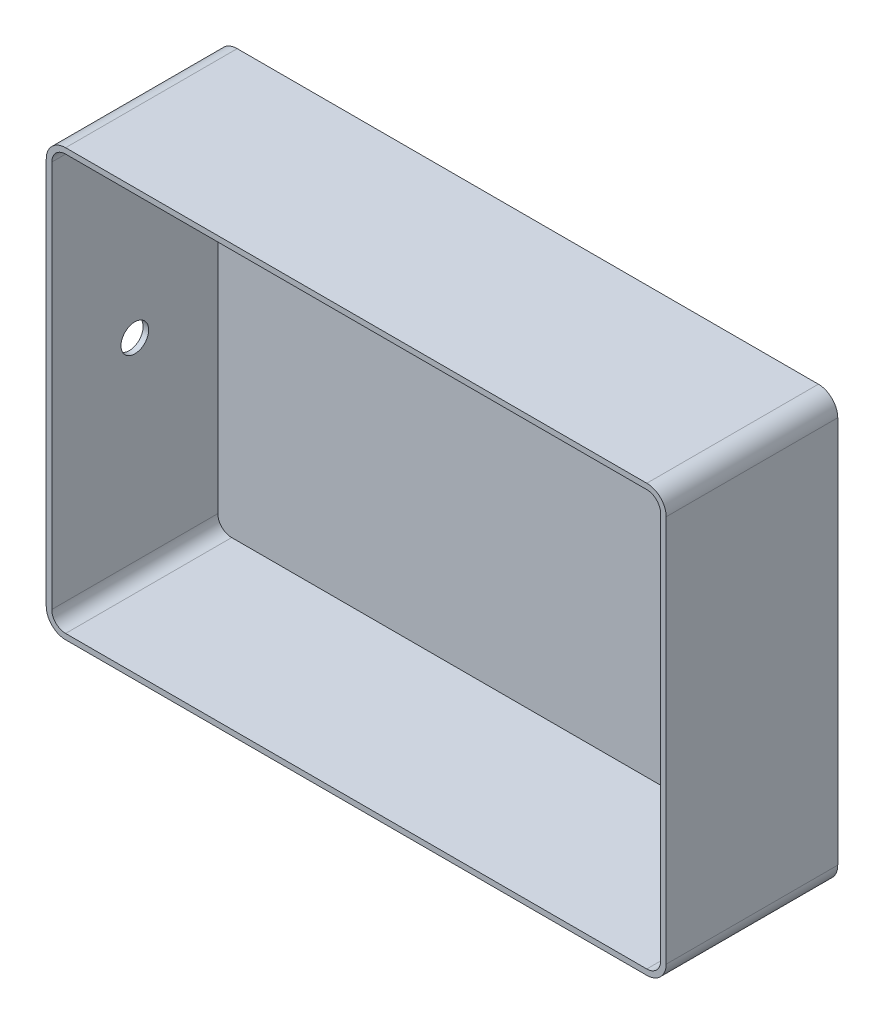
from build123d import *

# Parameters (mm, degrees)
BOSS_EXTRUDE1_DEPTH = 30
SHELL1_T            = 2
SKETCH2_R           = 5
CUT_EXTRUDE1_DEPTH  = 50


with BuildPart() as part:
    # Sketch1 → Boss-Extrude1 (new, symmetric)
    with BuildSketch(Plane.XY):
        with BuildLine():
            Line((-105, -75), (105, -75))
            ThreePointArc((105, -75), (108.535533906, -73.535533906), (110, -70))
            Line((110, -70), (110, 70))
            ThreePointArc((110, 70), (108.535533906, 73.535533906), (105, 75))
            Line((105, 75), (-105, 75))
            ThreePointArc((-105, 75), (-108.535533906, 73.535533906), (-110, 70))
            Line((-110, 70), (-110, -70))
            ThreePointArc((-110, -70), (-108.535533906, -73.535533906), (-105, -75))
        make_face()
    extrude(amount=BOSS_EXTRUDE1_DEPTH, both=True)

    # Shell1
    shell1_openings = [part.faces().sort_by_distance(p)[0] for p in [
        (0, 0, 30),
    ]]
    offset(amount=SHELL1_T, openings=shell1_openings, kind=Kind.INTERSECTION)

    # Sketch2 → Cut-Extrude1 (cut)
    with BuildSketch(Plane.ZY.offset(112)):
        with Locations(Location((0, 0, 0), (0, 0, 270))):
            Circle(SKETCH2_R)
    extrude(amount=-CUT_EXTRUDE1_DEPTH, mode=Mode.SUBTRACT)


solid = part.part
